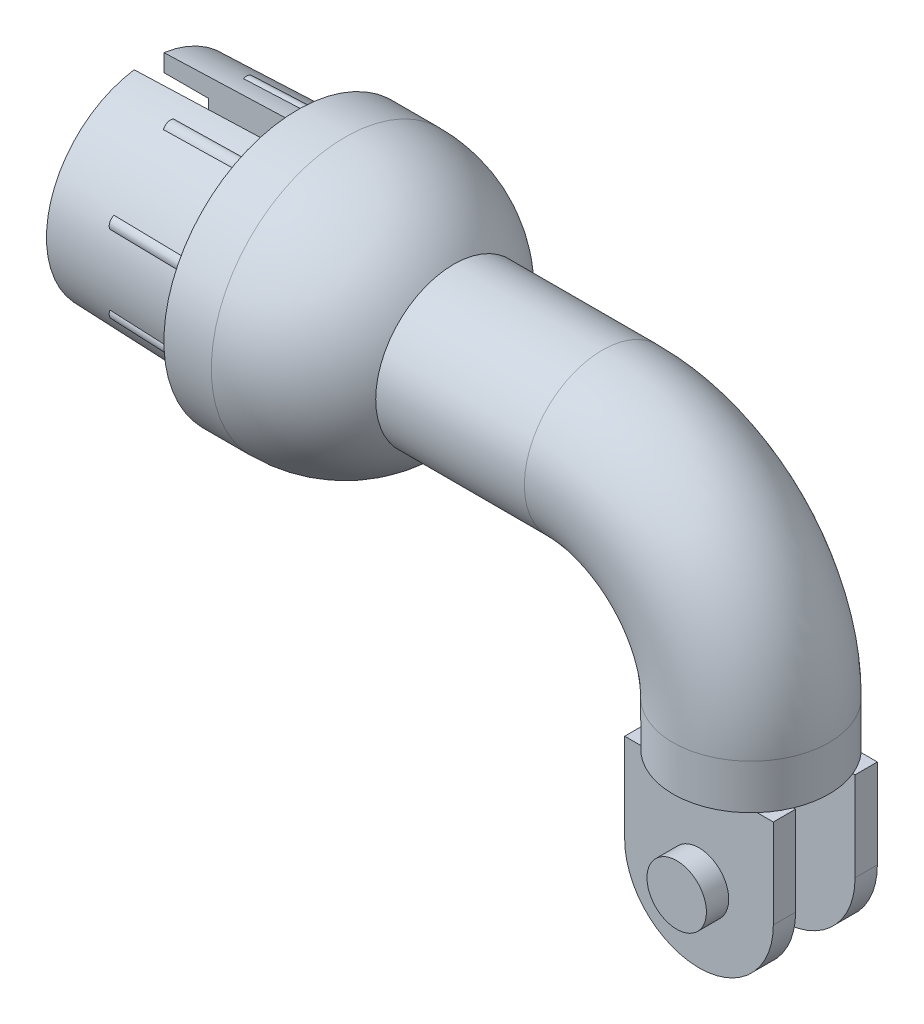
from build123d import *

# Parameters (mm, degrees)
SKETCH1_R           = 5.25
SKETCH4_R           = 7.25
BOSS_EXTRUDE1_DEPTH = 10
BOSS_EXTRUDE1_TAPER = 2
SHELL1_T            = -2
SKETCH7_R           = 0.5
CIRPATTERN1_COUNT   = 8
SKETCH8_R           = 5.75
CUT_EXTRUDE1_DEPTH  = 3
SKETCH9_W           = 9.4
SKETCH9_H           = 2
CUT_EXTRUDE2_DEPTH  = 51.052472547
BOSS_EXTRUDE2_DEPTH = 1.5
SKETCH11_R          = 2
BOSS_EXTRUDE3_DEPTH = 1.5


with BuildPart() as part:
    # Base-Sweep: sweep along a path in Sketch2
    with BuildLine(Plane.XY) as base_sweep_path:
        Line((0, 6), (0, 9))
        ThreePointArc((0, 9), (-2.928932188, 16.071067812), (-10, 19))
        Line((-10, 19), (-25, 19))
    # Sketch1 → Base-Sweep (sweep)
    with BuildSketch(Plane(origin=(0, 6, 0), x_dir=(-1, 0, 0), z_dir=(0, 1, 0))):
        Circle(SKETCH1_R)
    sweep(path=base_sweep_path.line)

    # Sketch3 → Boss-Revolve1 (revolve)
    with BuildSketch(Plane.XY, mode=Mode.PRIVATE) as boss_revolve1_sk:
        with BuildLine():
            Line((-27.310095759, 28), (-30.5, 28))
            Line((-30.5, 28), (-30.5, 19))
            Line((-30.5, 19), (-18.310095759, 19))
            ThreePointArc((-18.310095759, 19), (-20.946134728, 25.363961031), (-27.310095759, 28))
        make_face()
    revolve(boss_revolve1_sk.sketch.rotate(Axis((-36.172167942, 19, 0), (-1, 0, 0)), 90), axis=Axis((-36.172167942, 19, 0), (-1, 0, 0)))

    # Sketch4 → Boss-Extrude1 (add)
    with BuildSketch(Plane.ZY.offset(30.5)):
        with Locations((0, 19)):
            Circle(SKETCH4_R)
    extrude(amount=BOSS_EXTRUDE1_DEPTH, taper=BOSS_EXTRUDE1_TAPER)

    # Shell1
    shell1_openings = [part.faces().sort_by_distance(p)[0] for p in [
        (-40.5, 19, 0),
        (0, 6, 0),
    ]]
    offset(amount=SHELL1_T, openings=shell1_openings, kind=Kind.INTERSECTION)

    # Boss-Sweep1: sweep along a path in Sketch6
    with BuildLine(Plane(origin=(0, 2.782485579, 6.717514421), x_dir=(1, 0, 0), z_dir=(0, 0.38268343236509056, 0.9238795325112865))) as boss_sweep1_path:
        Line((-36.5, 24.594186501), (-30.5, 24.803711118))
    # Sketch7 → Boss-Sweep1 (sweep)
    with BuildSketch(Plane.ZY.offset(30.5)):
        with Locations((-2.640515683, 25.374768774)):
            Circle(SKETCH7_R)
    boss_sweep1 = sweep(path=boss_sweep1_path.line)

    # CirPattern1: Boss-Sweep1 ×8 about axis
    cirpattern1_axis = Axis((-36.172167942, 19, 0), (-1, 0, 0))
    for i in range(1, CIRPATTERN1_COUNT):
        add(boss_sweep1.rotate(cirpattern1_axis, i * 360 / CIRPATTERN1_COUNT))

    # Sketch8 → Cut-Extrude1 (cut)
    with BuildSketch(Plane.ZY.offset(40.5)):
        with Locations(Location((0, 19, 0), (0, 0, 270))):
            Circle(SKETCH8_R)
    extrude(amount=-CUT_EXTRUDE1_DEPTH, mode=Mode.SUBTRACT)

    # Sketch9 → Cut-Extrude2 (cut, through all)
    with BuildSketch(Plane(origin=(0, 0, 0), x_dir=(1, 0, 0), z_dir=(0, 1, 0))):
        with Locations((-35.8, 0)):
            Rectangle(SKETCH9_W, SKETCH9_H)
    extrude(amount=CUT_EXTRUDE2_DEPTH, mode=Mode.SUBTRACT)

    # Sketch10 → Boss-Extrude2 (add)
    with BuildSketch(Plane(origin=(0, 12.319, -3.5), x_dir=(1, 0, 0), z_dir=(0, 0, -1))):
        with BuildLine():
            Line((-5, 6.319), (5, 6.319))
            Line((5, 6.319), (5, 12.319))
            ThreePointArc((5, 12.319), (0, 17.319), (-5, 12.319))
            Line((-5, 12.319), (-5, 6.319))
        make_face()
    boss_extrude2 = extrude(amount=-BOSS_EXTRUDE2_DEPTH)

    # Sketch11 → Boss-Extrude3 (add)
    with BuildSketch(Plane(origin=(0, 0, -3.5), x_dir=(-1, 0, 0), z_dir=(0, 0, -1))):
        with Locations(Location((0, 0, 0), (0, 0, 180))):
            Circle(SKETCH11_R)
    boss_extrude3 = extrude(amount=BOSS_EXTRUDE3_DEPTH)

    # Mirror1: Boss-Extrude2, Boss-Extrude3 across plane
    add(boss_extrude2.mirror(Plane.XY))
    add(boss_extrude3.mirror(Plane.XY))


solid = part.part
